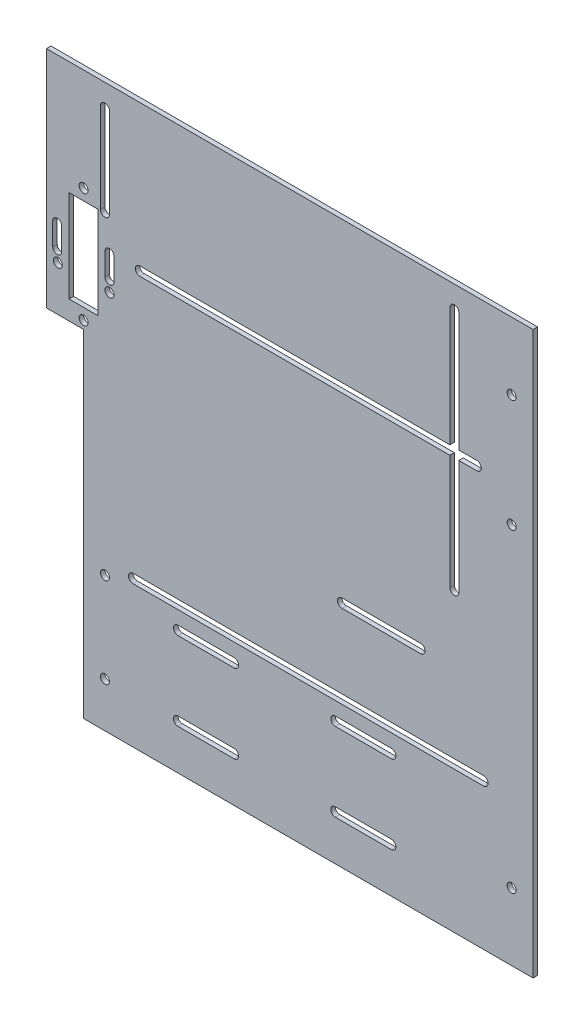
from build123d import *

# Parameters (mm, degrees)
SKETCH1_W           = 200
SKETCH1_H           = 200
BOSS_EXTRUDE1_DEPTH = 2
SKETCH2_R           = 2
CUT_EXTRUDE1_DEPTH  = 13
SKETCH3_R           = 2
CUT_EXTRUDE2_DEPTH  = 142.435497666
SKETCH4_R           = 2
CUT_EXTRUDE3_DEPTH  = 13
SKETCH5_W           = 2
SKETCH5_H           = 50
BOSS_EXTRUDE2_DEPTH = 16.5
SKETCH6_R           = 2
SKETCH6_W           = 13
SKETCH6_H           = 15
CUT_EXTRUDE4_DEPTH  = 154.545595834
SKETCH7_R           = 2
CUT_EXTRUDE5_DEPTH  = 154.545595834
CUT_EXTRUDE6_DEPTH  = 10
SKETCH11_W          = 216.5
SKETCH11_H          = 2
BOSS_EXTRUDE3_DEPTH = 50
CUT_EXTRUDE8_DEPTH  = 10
CUT_EXTRUDE9_DEPTH  = 10
CUT_EXTRUDE10_DEPTH = 10
SKETCH17_R          = 2
CUT_EXTRUDE11_DEPTH = 10
SKETCH18_R          = 2
CUT_EXTRUDE12_DEPTH = 10
CUT_EXTRUDE13_DEPTH = 10
CUT_EXTRUDE14_DEPTH = 10
CUT_EXTRUDE15_DEPTH = 10
SKETCH22_R          = 2
CUT_EXTRUDE16_DEPTH = 10
SKETCH23_W          = 13
SKETCH23_H          = 26
CUT_EXTRUDE17_DEPTH = 10
CUT_EXTRUDE20_DEPTH = 10


with BuildPart() as part:
    # Sketch1 → Boss-Extrude1 (new body)
    with BuildSketch(Plane.XY):
        Rectangle(SKETCH1_W, SKETCH1_H)
    extrude(amount=BOSS_EXTRUDE1_DEPTH)

    # Sketch2 → Cut-Extrude1 (cut)
    with BuildSketch(Plane.XY.offset(2)):
        with Locations((90.5, 70)):
            Circle(SKETCH2_R)
        with Locations((90.5, -70)):
            Circle(SKETCH2_R)
    extrude(amount=-CUT_EXTRUDE1_DEPTH, mode=Mode.SUBTRACT)

    # Sketch3 → Cut-Extrude2 (cut, through all)
    with BuildSketch(Plane.XY.offset(2)):
        with Locations((-90.5, -40)):
            Circle(SKETCH3_R)
        with Locations((-90.5, -80)):
            Circle(SKETCH3_R)
    extrude(amount=-CUT_EXTRUDE2_DEPTH, mode=Mode.SUBTRACT)

    # Sketch4 → Cut-Extrude3 (cut)
    with BuildSketch(Plane.XY.offset(2)):
        with Locations((-50, -45)):
            Circle(SKETCH4_R)
        with Locations((-50, -80)):
            Circle(SKETCH4_R)
        with Locations((26.5, -45)):
            Circle(SKETCH4_R)
        with Locations((26.5, -80)):
            Circle(SKETCH4_R)
    extrude(amount=-CUT_EXTRUDE3_DEPTH, mode=Mode.SUBTRACT)

    # Sketch5 → Boss-Extrude2 (add)
    with BuildSketch(Plane.ZY.offset(100)):
        with Locations((1, 75)):
            Rectangle(SKETCH5_W, SKETCH5_H)
    extrude(amount=BOSS_EXTRUDE2_DEPTH)

    # Sketch6 → Cut-Extrude4 (cut, through all)
    with BuildSketch(Plane.XY.offset(2)):
        with Locations((-111.5, 70)):
            Circle(SKETCH6_R)
        with Locations((-88.5, 70)):
            Circle(SKETCH6_R)
        with Locations((-100, 66)):
            Rectangle(SKETCH6_W, SKETCH6_H)
    extrude(amount=-CUT_EXTRUDE4_DEPTH, mode=Mode.SUBTRACT)

    # Sketch7 → Cut-Extrude5 (cut, through all)
    with BuildSketch(Plane.XY.offset(2)):
        with Locations((75, 85)):
            Circle(SKETCH7_R)
        with Locations((78, -35)):
            Circle(SKETCH7_R)
        with Locations((-78, -35)):
            Circle(SKETCH7_R)
        with Locations((-75, 85)):
            Circle(SKETCH7_R)
    extrude(amount=-CUT_EXTRUDE5_DEPTH, mode=Mode.SUBTRACT)

    # Sketch8 → Cut-Extrude6 (cut)
    with BuildSketch(Plane.XY.offset(2)):
        with BuildLine():
            Line((67, 95), (67, 32))
            ThreePointArc((67, 32), (65, 30), (63, 32))
            Line((63, 32), (63, 95))
            ThreePointArc((63, 95), (65, 97), (67, 95))
        make_face()
    extrude(amount=-CUT_EXTRUDE6_DEPTH, mode=Mode.SUBTRACT)

    # Sketch11 → Boss-Extrude3 (add)
    with BuildSketch(Plane(origin=(0, 100, 0), x_dir=(1, 0, 0), z_dir=(0, 1, 0))):
        with Locations((-8.25, -1)):
            Rectangle(SKETCH11_W, SKETCH11_H)
    extrude(amount=BOSS_EXTRUDE3_DEPTH)

    # Sketch12 → Cut-Extrude8 (cut)
    with BuildSketch(Plane.XY.offset(2)):
        with BuildLine():
            Line((63, 90.479574642), (63, 140))
            ThreePointArc((63, 140), (65, 142), (67, 140))
            Line((67, 140), (67, 90.479574642))
            ThreePointArc((67, 90.479574642), (65, 88.479574642), (63, 90.479574642))
        make_face()
    extrude(amount=-CUT_EXTRUDE8_DEPTH, mode=Mode.SUBTRACT)

    # Sketch15 → Cut-Extrude9 (cut)
    with BuildSketch(Plane.XY.offset(2)):
        with BuildLine():
            Line((-78, -33), (78, -33))
            ThreePointArc((78, -33), (80, -35), (78, -37))
            Line((78, -37), (-78, -37))
            ThreePointArc((-78, -37), (-80, -35), (-78, -33))
        make_face()
    extrude(amount=-CUT_EXTRUDE9_DEPTH, mode=Mode.SUBTRACT)

    # Sketch16 → Cut-Extrude10 (cut)
    with BuildSketch(Plane.XY.offset(2)):
        with BuildLine():
            Line((-75, 87), (75, 87))
            ThreePointArc((75, 87), (77, 85), (75, 83))
            Line((75, 83), (-75, 83))
            ThreePointArc((-75, 83), (-77, 85), (-75, 87))
        make_face()
    extrude(amount=-CUT_EXTRUDE10_DEPTH, mode=Mode.SUBTRACT)

    # Sketch17 → Cut-Extrude11 (cut)
    with BuildSketch(Plane.XY.offset(2)):
        with Locations((90.5, 120)):
            Circle(SKETCH17_R)
    extrude(amount=-CUT_EXTRUDE11_DEPTH, mode=Mode.SUBTRACT)

    # Sketch18 → Cut-Extrude12 (cut)
    with BuildSketch(Plane.XY.offset(2)):
        with Locations((-90.5, 120)):
            Circle(SKETCH18_R)
    extrude(amount=-CUT_EXTRUDE12_DEPTH, mode=Mode.SUBTRACT)

    # Sketch19 → Cut-Extrude13 (cut)
    with BuildSketch(Plane.XY.offset(2)):
        with BuildLine():
            Line((15, 4), (50, 4))
            ThreePointArc((50, 4), (52, 2), (50, 0))
            Line((50, 0), (15, 0))
            ThreePointArc((15, 0), (13, 2), (15, 4))
        make_face()
    extrude(amount=-CUT_EXTRUDE13_DEPTH, mode=Mode.SUBTRACT)

    # Sketch20 → Cut-Extrude14 (cut)
    with BuildSketch(Plane.XY.offset(2)):
        with BuildLine():
            Line((-58, -43), (-33, -43))
            ThreePointArc((-33, -43), (-31, -45), (-33, -47))
            Line((-33, -47), (-58, -47))
            ThreePointArc((-58, -47), (-60, -45), (-58, -43))
        make_face()
        with BuildLine():
            Line((-58, -78), (-33, -78))
            ThreePointArc((-33, -78), (-31, -80), (-33, -82))
            Line((-33, -82), (-58, -82))
            ThreePointArc((-58, -82), (-60, -80), (-58, -78))
        make_face()
        with BuildLine():
            Line((12, -43), (37, -43))
            ThreePointArc((37, -43), (39, -45), (37, -47))
            Line((37, -47), (12, -47))
            ThreePointArc((12, -47), (10, -45), (12, -43))
        make_face()
        with BuildLine():
            Line((12, -78), (37, -78))
            ThreePointArc((37, -78), (39, -80), (37, -82))
            Line((37, -82), (12, -82))
            ThreePointArc((12, -82), (10, -80), (12, -78))
        make_face()
    extrude(amount=-CUT_EXTRUDE14_DEPTH, mode=Mode.SUBTRACT)

    # Sketch21 → Cut-Extrude15 (cut)
    with BuildSketch(Plane.XY.offset(2)):
        with BuildLine():
            Line((-88.5, 140), (-88.5, 100))
            ThreePointArc((-88.5, 100), (-90.5, 98), (-92.5, 100))
            Line((-92.5, 100), (-92.5, 140))
            ThreePointArc((-92.5, 140), (-90.5, 142), (-88.5, 140))
        make_face()
    extrude(amount=-CUT_EXTRUDE15_DEPTH, mode=Mode.SUBTRACT)

    # Sketch22 → Cut-Extrude16 (cut)
    with BuildSketch(Plane.XY.offset(2)):
        with Locations((-100, 53.5)):
            Circle(SKETCH22_R)
        with Locations((-100, 104.5)):
            Circle(SKETCH22_R)
    extrude(amount=-CUT_EXTRUDE16_DEPTH, mode=Mode.SUBTRACT)

    # Sketch23 → Cut-Extrude17 (cut)
    with BuildSketch(Plane.XY.offset(2)):
        with Locations((-100, 86.5)):
            Rectangle(SKETCH23_W, SKETCH23_H)
    extrude(amount=-CUT_EXTRUDE17_DEPTH, mode=Mode.SUBTRACT)

    # Sketch24 → Cut-Extrude20 (cut)
    with BuildSketch(Plane.XY.offset(2)):
        with BuildLine():
            Line((-90.5, 75), (-90.5, 85))
            ThreePointArc((-90.5, 85), (-88.5, 87), (-86.5, 85))
            Line((-86.5, 85), (-86.5, 75))
            ThreePointArc((-86.5, 75), (-88.5, 73), (-90.5, 75))
        make_face()
        with BuildLine():
            Line((-113.741584086, 75), (-113.741584086, 85))
            ThreePointArc((-113.741584086, 85), (-111.741584086, 87), (-109.741584086, 85))
            Line((-109.741584086, 85), (-109.741584086, 75))
            ThreePointArc((-109.741584086, 75), (-111.741584086, 73), (-113.741584086, 75))
        make_face()
    extrude(amount=-CUT_EXTRUDE20_DEPTH, mode=Mode.SUBTRACT)


solid = part.part
